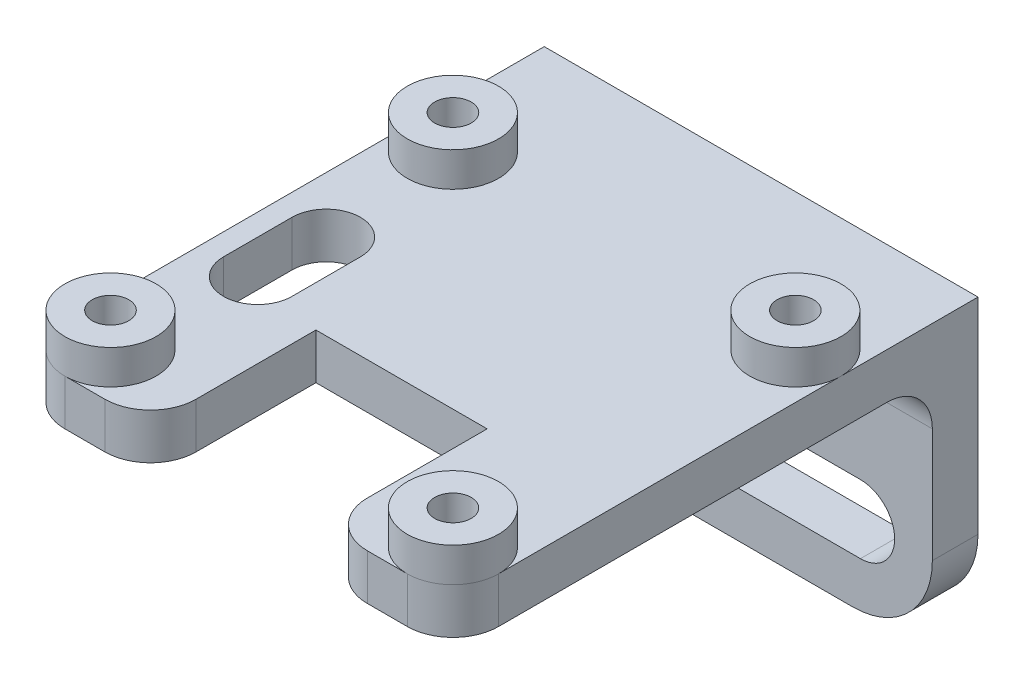
from build123d import *

# Parameters (mm, degrees)
SKETCH1_W            = 38
SKETCH1_H            = 25
BOSS_EXTRUDE1_DEPTH  = 7
SKETCH2_W            = 38
SKETCH2_H            = 6
BOSS_EXTRUDE2_DEPTH  = 39
CUT_EXTRUDE2_DEPTH   = 46.90206967
SKETCH4_R            = 1.6
CUT_EXTRUDE3_DEPTH   = 56.695601263
BOSS_EXTRUDE3_START  = 3
SKETCH6_R            = 4
SKETCH6_R_2          = 1.6
BOSS_EXTRUDE3_DEPTH  = 3
LPATTERN2_COUNT      = 2
LPATTERN2_PITCH      = 30
LPATTERN2_COUNT_DIR2 = 2
LPATTERN2_PITCH_DIR2 = 30
CUT_EXTRUDE4_DEPTH   = 54.272882407
SKETCH8_W            = 15
SKETCH8_H            = 14.496545463
CUT_EXTRUDE5_DEPTH   = 54.272882407
CUT_EXTRUDE7_DEPTH   = 2
SKETCH9_W            = 38
SKETCH9_H            = 21
CUT_EXTRUDE6_DEPTH   = 3
FILLET1_R            = 4
FILLET2_R            = 4
FILLET3_R            = 7


with BuildPart() as part:
    # Sketch1 → Boss-Extrude1 (new body)
    with BuildSketch(Plane.XY):
        with Locations((0, 2.5)):
            Rectangle(SKETCH1_W, SKETCH1_H)
    extrude(amount=BOSS_EXTRUDE1_DEPTH)

    # Sketch2 → Boss-Extrude2 (add)
    with BuildSketch(Plane.XY.offset(7)):
        with Locations((0, 12)):
            Rectangle(SKETCH2_W, SKETCH2_H)
    extrude(amount=BOSS_EXTRUDE2_DEPTH)

    # Sketch3 → Cut-Extrude2 (cut, through all)
    with BuildSketch(Plane.XY.offset(7)):
        with BuildLine():
            Line((-12.7, 0), (12.7, 0))
            ThreePointArc((12.7, 0), (15.7, -3), (12.7, -6))
            Line((12.7, -6), (-12.7, -6))
            ThreePointArc((-12.7, -6), (-15.7, -3), (-12.7, 0))
        make_face()
    extrude(amount=-CUT_EXTRUDE2_DEPTH, mode=Mode.SUBTRACT)

    # Sketch4 → Cut-Extrude3 (cut, through all)
    with BuildSketch(Plane(origin=(0, 15, 0), x_dir=(1, 0, 0), z_dir=(0, 1, 0))):
        with Locations(Location((-15, -12, 0), (0, 0, 270))):
            Circle(SKETCH4_R)
    cut_extrude3 = extrude(amount=-CUT_EXTRUDE3_DEPTH, mode=Mode.SUBTRACT)

    # Sketch6 → Boss-Extrude3 (add)
    with BuildSketch(Plane(origin=(0, 15, 0), x_dir=(1, 0, 0), z_dir=(0, 1, 0)).offset(BOSS_EXTRUDE3_START)):
        with Locations(Location((-15, -12, 0), (0, 0, 180))):
            Circle(SKETCH6_R)
        with Locations(Location((-15, -12, 0), (0, 0, 270))):
            Circle(SKETCH6_R_2, mode=Mode.SUBTRACT)
    boss_extrude3 = extrude(amount=-BOSS_EXTRUDE3_DEPTH)

    # LPattern2: Cut-Extrude3, Boss-Extrude3 2 × 2
    with Locations(*[(i * LPATTERN2_PITCH, 0, j * LPATTERN2_PITCH_DIR2) for i in range(LPATTERN2_COUNT) for j in range(LPATTERN2_COUNT_DIR2) if (i, j) != (0, 0)]):
        add(cut_extrude3, mode=Mode.SUBTRACT)
        add(boss_extrude3)

    # Sketch7 → Cut-Extrude4 (cut, through all)
    with BuildSketch(Plane.XZ.offset(-9)):
        with BuildLine():
            Line((-11.1, 30), (-11.1, 24))
            ThreePointArc((-11.1, 24), (-14.1, 21), (-17.1, 24))
            Line((-17.1, 24), (-17.1, 30))
            ThreePointArc((-17.1, 30), (-14.1, 33), (-11.1, 30))
        make_face()
    extrude(amount=-CUT_EXTRUDE4_DEPTH, mode=Mode.SUBTRACT)

    # Sketch8 → Cut-Extrude5 (cut, through all)
    with BuildSketch(Plane.XZ.offset(-9)):
        with Locations((0, 38.751727269)):
            Rectangle(SKETCH8_W, SKETCH8_H)
    extrude(amount=-CUT_EXTRUDE5_DEPTH, mode=Mode.SUBTRACT)

    # Sketch10 → Cut-Extrude7 (cut)
    with BuildSketch(Plane.XZ.offset(-9)):
        Polygon((7.5, 31.503454537), (-7.5, 31.503454537), (-7.5, 46), (-19, 46), (-19, 7), (19, 7), (19, 46), (7.5, 46), align=None)
    extrude(amount=-CUT_EXTRUDE7_DEPTH, mode=Mode.SUBTRACT)

    # Sketch9 → Cut-Extrude6 (cut)
    with BuildSketch(Plane.XY.offset(7)):
        with Locations((0, 0.5)):
            Rectangle(SKETCH9_W, SKETCH9_H)
    extrude(amount=-CUT_EXTRUDE6_DEPTH, mode=Mode.SUBTRACT)

    # Fillet1
    fillet1_edges = [part.edges().sort_by_distance(p)[0] for p in [
        (0, 11, 4),
    ]]
    fillet(fillet1_edges, radius=FILLET1_R)

    # Fillet2
    fillet2_edges = [part.edges().sort_by_distance(p)[0] for p in [
        (-19, 13, 46),
        (19, 13, 46),
        (-7.5, 13, 46),
        (7.5, 13, 46),
    ]]
    fillet(fillet2_edges, radius=FILLET2_R)

    # Fillet3
    fillet3_edges = [part.edges().sort_by_distance(p)[0] for p in [
        (19, -10, 2),
        (-19, -10, 2),
    ]]
    fillet(fillet3_edges, radius=FILLET3_R)


solid = part.part
